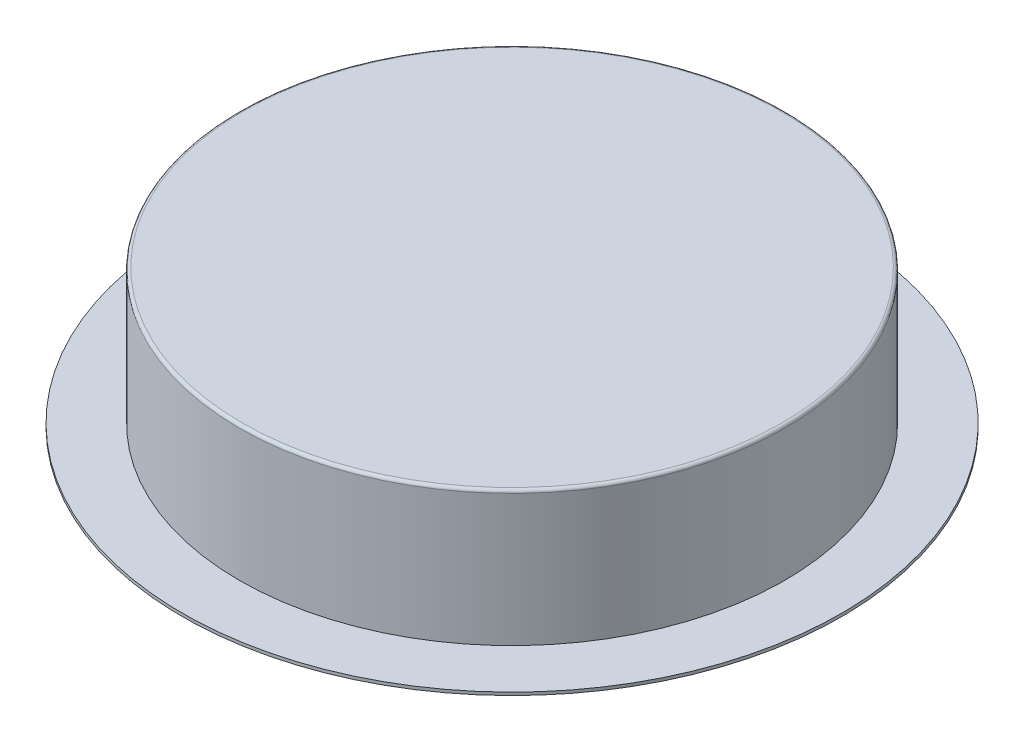
from build123d import *

# Parameters (mm, degrees)
SKETCH_1_R      = 45.5
SKETCH_1_R_2    = 45
EXTRUDE_1_DEPTH = 22
SKETCH_2_R      = 55
SKETCH_2_R_2    = 45
EXTRUDE_2_DEPTH = 0.5
SKETCH_3_R      = 45.5
EXTRUDE_3_DEPTH = 0.5
FILLET_2_R      = 0.5


with BuildPart() as part:
    # Эскиз1 → Вытянуть1 (new body)
    with BuildSketch(Plane(origin=(0, 0, 0), x_dir=(1, 0, 0), z_dir=(0, 1, 0))):
        with Locations(Location((0, 0, 0), (0, 0, 270))):
            Circle(SKETCH_1_R)
        with Locations(Location((0, 0, 0), (0, 0, 270))):
            Circle(SKETCH_1_R_2, mode=Mode.SUBTRACT)
    extrude(amount=EXTRUDE_1_DEPTH)

    # Эскиз3 → Вытянуть3 (add)
    with BuildSketch(Plane(origin=(0, 22, 0), x_dir=(1, 0, 0), z_dir=(0, 1, 0))):
        with Locations(Location((0, 0, 0), (0, 0, 270))):
            Circle(SKETCH_3_R)
    extrude(amount=EXTRUDE_3_DEPTH)

    # Скругление2
    fillet_2_edges = [part.edges().sort_by_distance(p)[0] for p in [
        (0, 22.5, -45.5),
    ]]
    fillet(fillet_2_edges, radius=FILLET_2_R)


with BuildPart() as body_2:
    # Эскиз2 → Вытянуть2 (new body)
    with BuildSketch(Plane.XZ):
        with Locations(Location((0, 0, 0), (0, 0, 270))):
            Circle(SKETCH_2_R)
        with Locations(Location((0, 0, 0), (0, 0, 270))):
            Circle(SKETCH_2_R_2, mode=Mode.SUBTRACT)
    extrude(amount=EXTRUDE_2_DEPTH)


solid = Compound([part.part, body_2.part])
